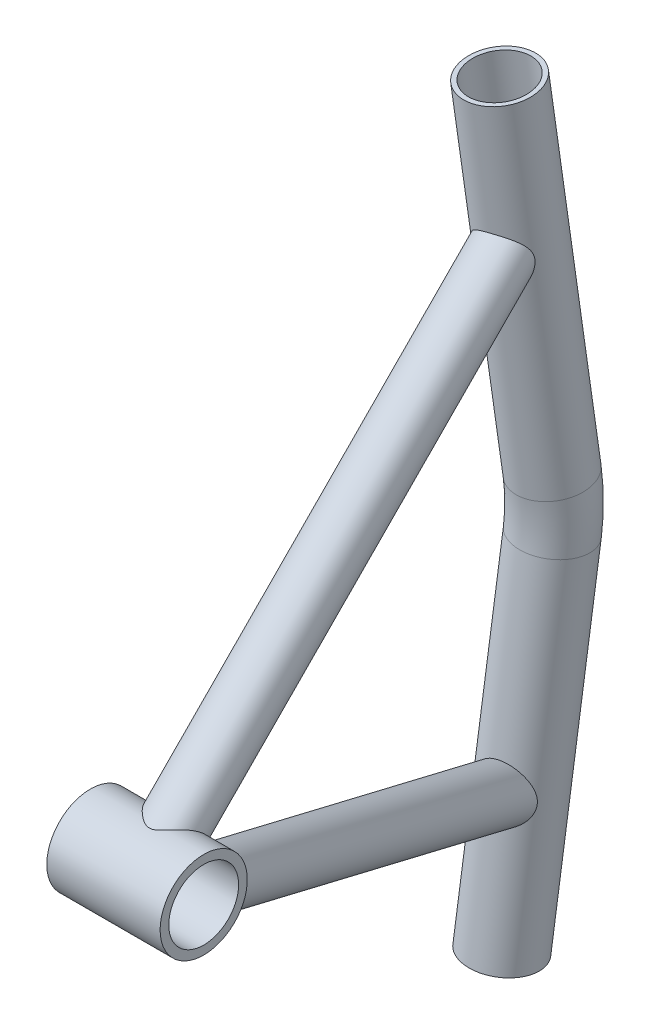
from build123d import *

# Parameters (mm, degrees)
SKETCH6_W                = 41.275
SKETCH6_H                = 3.1496
BOSS_EXTRUDE1_REACH      = 236.297
BOSS_EXTRUDE1_END_RADIUS = 15.875
SKETCH10_R               = 9.525
SKETCH10_R_2             = 7.874
BOSS_EXTRUDE2_REACH      = 283.248
BOSS_EXTRUDE2_END_RADIUS = 15.875
SKETCH11_R               = 9.525
SKETCH11_R_2             = 7.874
SKETCH12_R               = 12.7
SKETCH15_R               = 12.7
SKETCH15_R_2             = 11.049


with BuildPart() as part:
    # Sketch6 → Revolve2 (revolve)
    with BuildSketch(Plane(origin=(0, 0, 0), x_dir=(1, 0, 0), z_dir=(0, 1, 0)), mode=Mode.PRIVATE) as revolve2_sk:
        with Locations((0, 14.3002)):
            Rectangle(SKETCH6_W, SKETCH6_H)
    revolve(revolve2_sk.sketch.rotate(Axis((-66.78681796, 0, 0), (1, 0, 0)), 180), axis=Axis((-66.78681796, 0, 0), (1, 0, 0)))


with BuildPart() as body_2:
    # Boss-Extrude1: up to this cylinder (the profile starts outside it)
    boss_extrude1_end = Plane(origin=(-46.257491, 0, 0), z_dir=(-1, 0, 0)) * Cylinder(BOSS_EXTRUDE1_END_RADIUS, 505.344, mode=Mode.PRIVATE)
    # Sketch10 → Boss-Extrude1 (new, up to the surface)
    with BuildSketch(Plane(origin=(-46.257490993, 90.687540521, -181.772575541), x_dir=(-0.9710805667769234, -0.09902369397430037, 0.2172483391418525), z_dir=(-0.23874419476117373, 0.4101204671704958, -0.8802286134156814)), mode=Mode.PRIVATE) as boss_extrude1_sk1:
        with Locations(Location((0, 0, 0), (0, 0, 89.885860526))):
            Circle(SKETCH10_R)
        with Locations(Location((0, 0, 0), (0, 0, 89.885860526))):
            Circle(SKETCH10_R_2, mode=Mode.SUBTRACT)
    boss_extrude1_tool1 = extrude(boss_extrude1_sk1.sketch, amount=-BOSS_EXTRUDE1_REACH, mode=Mode.PRIVATE) - boss_extrude1_end
    add(boss_extrude1_tool1.solids().sort_by_distance((-46.257491, 82.297896, -185.68152))[0])


with BuildPart() as body_3:
    # Boss-Extrude2: up to this cylinder (the profile starts outside it)
    boss_extrude2_end = Plane(origin=(-46.59229, 0, 0), z_dir=(-1, 0, 0)) * Cylinder(BOSS_EXTRUDE2_END_RADIUS, 599.246, mode=Mode.PRIVATE)
    # Sketch11 → Boss-Extrude2 (new, up to the surface)
    with BuildSketch(Plane(origin=(-46.592290414, -87.779849456, -183.006951233), x_dir=(-0.9706542952078342, 0.09961561790365697, 0.21887660419573265), z_dir=(-0.24047216176870762, -0.3951132900155316, -0.8865994740960469)), mode=Mode.PRIVATE) as boss_extrude2_sk1:
        with Locations(Location((0, 0, 0), (0, 0, 89.891500811))):
            Circle(SKETCH11_R)
        with Locations(Location((0, 0, 0), (0, 0, 89.891500811))):
            Circle(SKETCH11_R_2, mode=Mode.SUBTRACT)
    boss_extrude2_tool1 = extrude(boss_extrude2_sk1.sketch, amount=-BOSS_EXTRUDE2_REACH, mode=Mode.PRIVATE) - boss_extrude2_end
    add(boss_extrude2_tool1.solids().sort_by_distance((-46.59229, -96.233929, -179.239388))[0])


with BuildPart() as cut_sweep1_tool:
    # Cut-Sweep1: sweep along a curve in space
    with BuildLine() as cut_sweep1_path:
        Line((-48.411844599, 138.351090877, -176.819338526), (-42.611355849, 10.019378374, -190.15568011))
        ThreePointArc((-42.611355849, 10.019378374, -190.15568011), (-42.406082457, 0.376838357, -190.682639824), (-42.659018694, -9.269942166, -190.265446224))
        Line((-42.659018694, -9.269942166, -190.265446224), (-49.130913586, -138.45193213, -178.322153213))
    # Sketch12 → Cut-Sweep1 (sweep)
    with BuildSketch(Plane(origin=(-49.130913586, -138.45193213, -178.322153213), x_dir=(-0.9987579915812498, 0.049603819400959905, -0.004683519341809774), z_dir=(-0.049824339966109084, -0.9945166744943245, 0.09194628486073564))):
        Circle(SKETCH12_R)
    sweep(path=cut_sweep1_path.line)


with BuildPart() as body_2_1:
    add(body_2.part)

    # Cut-Sweep1: cut by cut_sweep1_tool
    add(cut_sweep1_tool.part, mode=Mode.SUBTRACT)


with BuildPart() as body_3_1:
    add(body_3.part)

    # Cut-Sweep1: cut by cut_sweep1_tool
    add(cut_sweep1_tool.part, mode=Mode.SUBTRACT)


with BuildPart() as body_4:
    # Sweep2: sweep along a path in Sketch14
    with BuildLine(Plane(origin=(-109.219490339, 0.571489784, -53.003043086), x_dir=(0.4365945323887518, 5.986852696490802e-08, -0.8996583875495429), z_dir=(0.899648419573701, -0.004707400477552739, 0.43658969472410386))) as sweep2_path:
        Line((137.940662614, 137.781119432), (152.47126817, 9.447984144))
        ThreePointArc((152.47126817, 9.447984144), (153.03497256, -0.194662746), (152.549209682, -9.841550126))
        Line((152.549209682, -9.841550126), (138.978724292, -139.024970613))
    # Sketch15 → Sweep2 (sweep)
    with BuildSketch(Plane(origin=(-49.130913586, -138.45193213, -178.322153213), x_dir=(-0.9987579915812498, 0.049603819400959905, -0.004683519341809774), z_dir=(-0.049824339966109084, -0.9945166744943245, 0.09194628486073564))):
        Circle(SKETCH15_R)
        Circle(SKETCH15_R_2, mode=Mode.SUBTRACT)
    sweep(path=sweep2_path.line)


solid = Compound([part.part, body_2_1.part, body_3_1.part, body_4.part])
